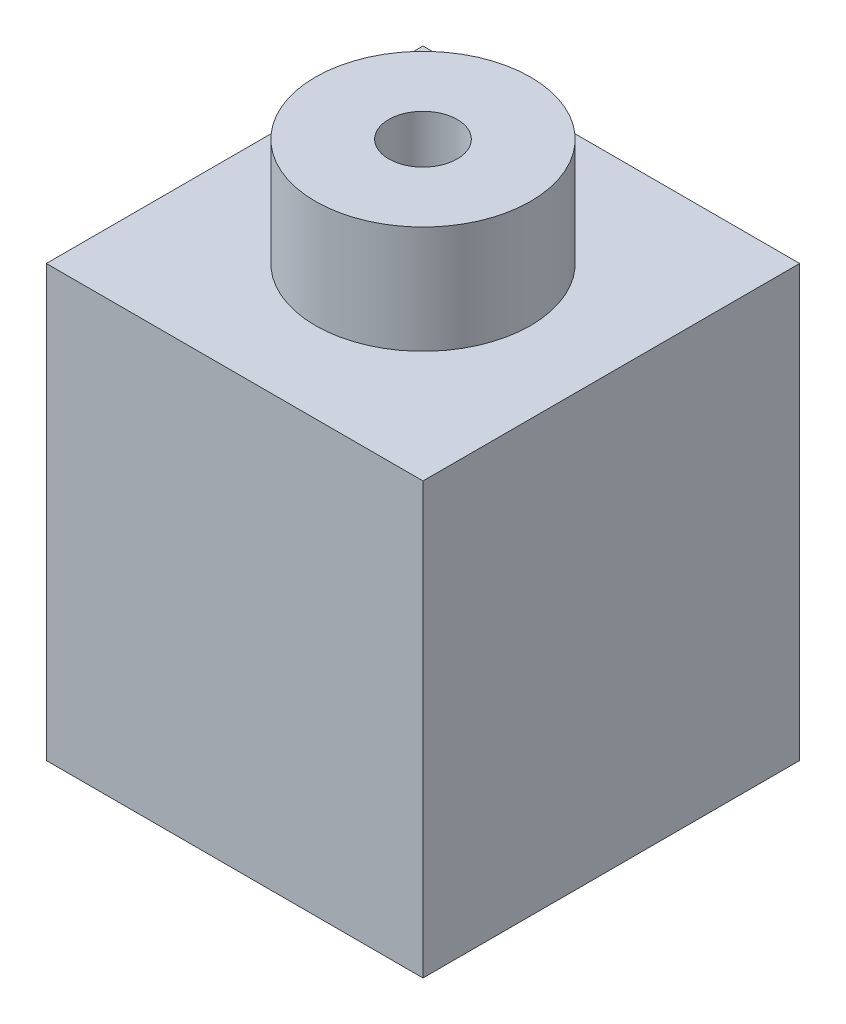
from build123d import *

# Parameters (mm, degrees)
SKETCH1_W              = 22.225
SKETCH1_H              = 22.225
BOSS_EXTRUDE1_DEPTH    = 25.4
SKETCH2_R              = 6.35
BOSS_EXTRUDE2_DEPTH    = 6.35
F_10_32_TAPPED_HOLE1_D = 4.0386
SKETCH6_W              = 17.145
SKETCH6_H              = 17.145
SKETCH6_R              = 5.1943
CUT_EXTRUDE1_DEPTH     = 21.59
SKETCH7_W              = 17.145
SKETCH7_H              = 17.145
SKETCH7_R              = 5.1943
BOSS_EXTRUDE3_DEPTH    = 3.81


with BuildPart() as part:
    # Sketch1 → Boss-Extrude1 (new body)
    with BuildSketch(Plane(origin=(0, 0, 0), x_dir=(1, 0, 0), z_dir=(0, 1, 0))):
        Rectangle(SKETCH1_W, SKETCH1_H)
    extrude(amount=BOSS_EXTRUDE1_DEPTH)

    # Sketch2 → Boss-Extrude2 (add)
    with BuildSketch(Plane(origin=(0, 25.4, 0), x_dir=(1, 0, 0), z_dir=(0, 1, 0))):
        with Locations(Location((0, 0, 0), (0, 0, 90))):
            Circle(SKETCH2_R)
    extrude(amount=BOSS_EXTRUDE2_DEPTH)

    # #10-32 Tapped Hole1 (through all)
    with Locations(Plane(origin=(0, 31.75, 0), x_dir=(1, 0, 0), z_dir=(0, 1, 0))):
        with Locations((0, 0)):
            Hole(F_10_32_TAPPED_HOLE1_D / 2)

    # Sketch6 → Cut-Extrude1 (cut)
    with BuildSketch(Plane.XZ):
        Rectangle(SKETCH6_W, SKETCH6_H)
        with Locations(Location((0, 0, 0), (0, 0, 270))):
            Circle(SKETCH6_R, mode=Mode.SUBTRACT)
    extrude(amount=-CUT_EXTRUDE1_DEPTH, mode=Mode.SUBTRACT)

    # Sketch7 → Boss-Extrude3 (add)
    with BuildSketch(Plane(origin=(0, 0, 0), x_dir=(-1, 0, 0), z_dir=(0, -1, 0))):
        Rectangle(SKETCH7_W, SKETCH7_H)
        with Locations(Location((0, 0, 0), (0, 0, 90))):
            Circle(SKETCH7_R, mode=Mode.SUBTRACT)
    extrude(amount=-BOSS_EXTRUDE3_DEPTH)


solid = part.part
